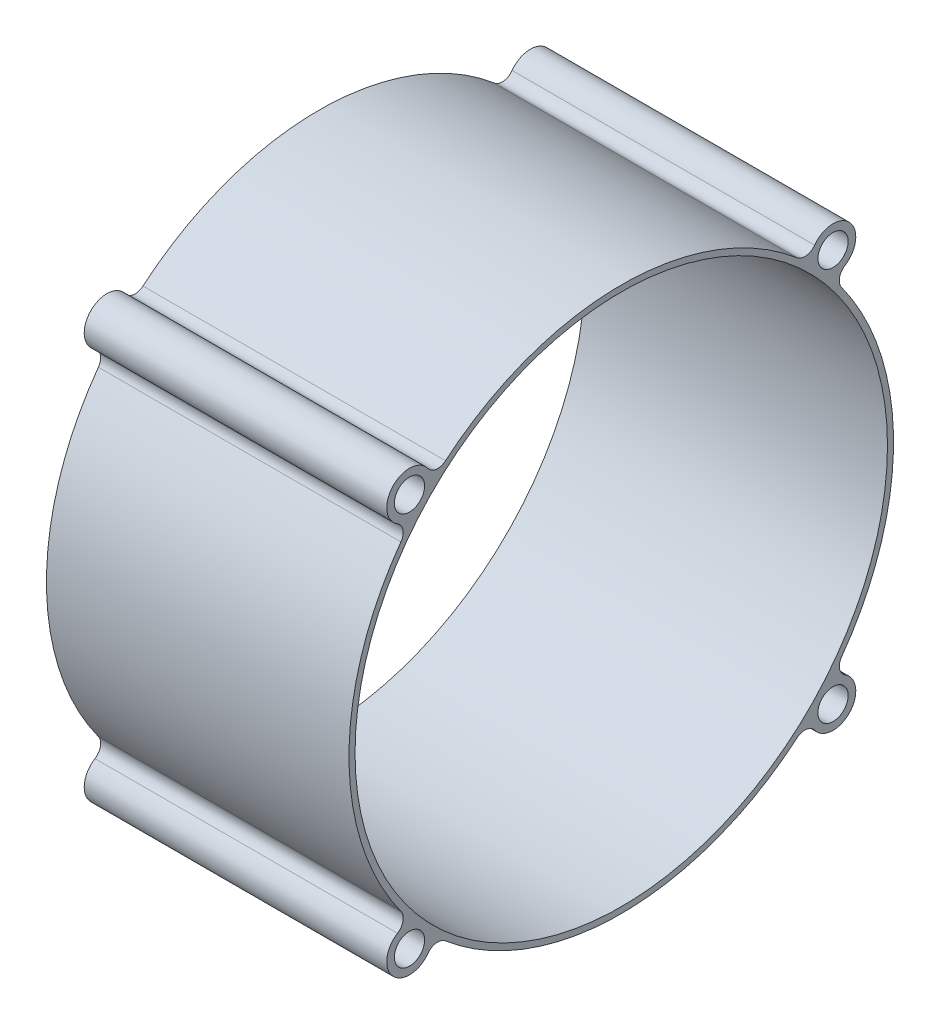
from build123d import *

# Parameters (mm, degrees)
SKETCH1_R           = 45
SKETCH1_R_2         = 44
SKETCH1_R_3         = 3.762432936
SKETCH1_R_4         = 2.5
BOSS_EXTRUDE5_DEPTH = 50
SKETCH2_R           = 2.5
CUT_EXTRUDE1_DEPTH  = 50
FILLET1_R           = 2


with BuildPart() as part:
    # Sketch1 → Boss-Extrude5 (new body)
    # profile 1 of 5: a face of its own
    with BuildSketch(Plane(origin=(0, 0, 0), x_dir=(0, 0, -1), z_dir=(1, 0, 0))):
        Circle(SKETCH1_R)
        Circle(SKETCH1_R_2, mode=Mode.SUBTRACT)
    # profile 2 of 5: a face of its own
    with BuildSketch(Plane(origin=(0, 0, 0), x_dir=(0, 0, -1), z_dir=(1, 0, 0))):
        with Locations((-35, 32.5)):
            Circle(SKETCH1_R_3)
        with Locations((-35, 32.5)):
            Circle(SKETCH1_R_4, mode=Mode.SUBTRACT)
    # profile 3 of 5: a face of its own
    with BuildSketch(Plane(origin=(0, 0, 0), x_dir=(0, 0, -1), z_dir=(1, 0, 0))):
        with Locations((-35, -32.5)):
            Circle(SKETCH1_R_3)
        with Locations((-35, -32.5)):
            Circle(SKETCH1_R_4, mode=Mode.SUBTRACT)
    # profile 4 of 5: a face of its own
    with BuildSketch(Plane(origin=(0, 0, 0), x_dir=(0, 0, -1), z_dir=(1, 0, 0))):
        with Locations((35, -32.5)):
            Circle(SKETCH1_R_3)
    # profile 5 of 5: a face of its own
    with BuildSketch(Plane(origin=(0, 0, 0), x_dir=(0, 0, -1), z_dir=(1, 0, 0))):
        with Locations((35, 32.5)):
            Circle(SKETCH1_R_3)
        with Locations((35, 32.5)):
            Circle(SKETCH1_R_4, mode=Mode.SUBTRACT)
    extrude(amount=BOSS_EXTRUDE5_DEPTH)

    # Sketch2 → Cut-Extrude1 (cut)
    with BuildSketch(Plane(origin=(50, 0, 0), x_dir=(0, 0, -1), z_dir=(1, 0, 0))):
        with Locations((35, -32.5)):
            Circle(SKETCH2_R)
    extrude(amount=-CUT_EXTRUDE1_DEPTH, mode=Mode.SUBTRACT)

    # Fillet1
    fillet1_edges = [part.edges().sort_by_distance(p)[0] for p in [
        (25, -28.757613043, 34.612132151),
        (25, 28.757613043, 34.612132151),
        (25, 32.390028906, 31.239174564),
        (25, -32.390028906, 31.239174564),
        (25, 28.757613043, -34.612132151),
        (25, 32.390028906, -31.239174564),
        (25, -32.390028906, -31.239174564),
        (25, -28.757613043, -34.612132151),
    ]]
    fillet(fillet1_edges, radius=FILLET1_R)


solid = part.part
